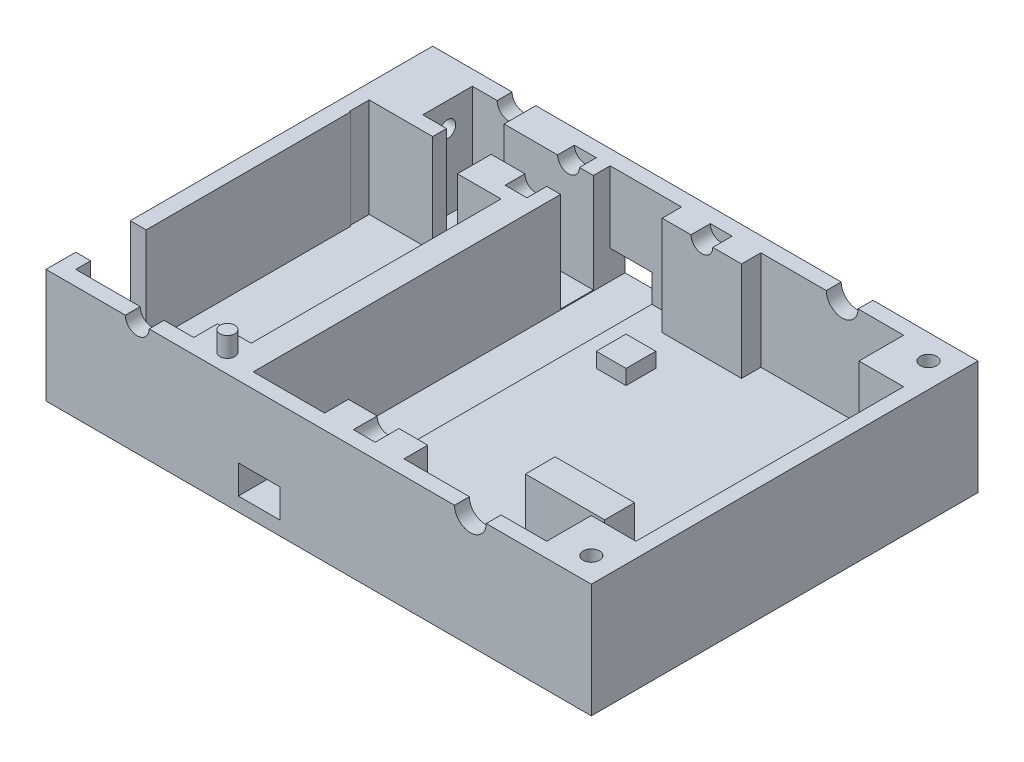
from build123d import *

# Parameters (mm, degrees)
SKETCH_1_W            = 55
SKETCH_1_H            = 39
EXTRUDE_1_DEPTH       = 11.5
SHELL_1_T             = -1.5
SKETCH_2_R            = 1.6
SKETCH_2_R_2          = 1.2
SKETCH_2_W            = 4.2
SKETCH_2_H            = 2.9
CUT_EXTRUDE_1_DEPTH   = 50.086658065
SKETCH_3_W            = 0.1
SKETCH_3_H            = 20.6
SKETCH_3_W_2          = 9
SKETCH_3_H_2          = 1.7
SKETCH_3_W_3          = 8
SKETCH_3_H_3          = 1.95
SKETCH_3_H_4          = 2.4
SKETCH_3_W_4          = 4.5
SKETCH_3_H_5          = 4.5
EXTRUDE_2_DEPTH       = 10
CUT_EXTRUDE_START     = -1.5
SKETCH_4_R            = 1.1
CUT_EXTRUDE_2_DEPTH   = 36
SKETCH_5_R            = 1.1
CUT_EXTRUDE_3_DEPTH   = 7
EXTRUDE_3_DEPTH       = 1.5
EXTRUDE_3_DEPTH_BACK  = 1.5
SKETCH_6_W            = 3
SKETCH_6_H            = 3
SKETCH_6_W_2          = 4.5
SKETCH_6_H_2          = 8
SKETCH_7_R            = 1
SKETCH_7_R_2          = 0.825
CUT_EXTRUDE_4_DEPTH   = 40.198214245
SKETCH_8_R            = 1
CUT_EXTRUDE_5_DEPTH   = 39.784661917
CUT_EXTRUDE_6_REACH   = 61.477
SKETCH_9_R            = 0.825
SKETCH_10_W           = 8
SKETCH_10_H           = 3
F_3MM_4_DEPTH         = 7
CUT_EXTRUDE_4_2_REACH = 61.477
SKETCH_11_W           = 5.5
SKETCH_11_H           = 8
SKETCH_12_R           = 0.75
EXTRUDE_5_DEPTH       = 2


with BuildPart() as part:
    # 草图1 → 凸台-拉伸1 (new body)
    with BuildSketch(Plane(origin=(0, 0, 0), x_dir=(1, 0, 0), z_dir=(0, 1, 0))):
        Rectangle(SKETCH_1_W, SKETCH_1_H)
    extrude(amount=EXTRUDE_1_DEPTH)

    # 抽壳1
    shell_1_openings = [part.faces().sort_by_distance(p)[0] for p in [
        (0, 11.5, 0),
    ]]
    offset(amount=SHELL_1_T, openings=shell_1_openings, kind=Kind.INTERSECTION)

    # 草图2 → 切除-拉伸1 (cut, through all)
    with BuildSketch(Plane(origin=(0, 0, -19.5), x_dir=(-1, 0, 0), z_dir=(0, 0, -1))):
        with Locations((-15.3, 11.5)):
            Circle(SKETCH_2_R)
        with Locations((18.3, 11.5)):
            Circle(SKETCH_2_R_2)
        with Locations((6, 2.85)):
            Rectangle(SKETCH_2_W, SKETCH_2_H)
    extrude(amount=-CUT_EXTRUDE_1_DEPTH, mode=Mode.SUBTRACT)

    # 草图3 → 凸台-拉伸2 (add)
    with BuildSketch(Plane(origin=(0, 1.5, 0), x_dir=(1, 0, 0), z_dir=(0, 1, 0))):
        Polygon((-10.7, 9.6), (-10.7, -15.6), (-14.1, -15.6), (-14.1, -18), (-10.7, -18), (-8.1, -18), (-8.1, 13), (-15.1, 13), (-15.1, 9.6), align=None)
        with Locations((-25.95, -0.7)):
            Rectangle(SKETCH_3_W, SKETCH_3_H)
        with Locations((-12.6, 17.15)):
            Rectangle(SKETCH_3_W_2, SKETCH_3_H_2)
        with Locations((3.1, 17.025)):
            Rectangle(SKETCH_3_W_3, SKETCH_3_H_3)
        with Locations((3.1, -16.8)):
            Rectangle(SKETCH_3_W_3, SKETCH_3_H_4)
        with Locations((23.75, 15.75)):
            Rectangle(SKETCH_3_W_4, SKETCH_3_H_5)
        with Locations((23.75, -15.75)):
            Rectangle(SKETCH_3_W_4, SKETCH_3_H_5)
        Polygon((-26, 18), (-22, 18), (-22, 13), (-19.6, 13), (-19.6, 11.6), (-26, 11.6), (-26, 13), align=None)
    extrude(amount=EXTRUDE_2_DEPTH)

    # 草图4 → 切除-拉伸2 (cut)
    with BuildSketch(Plane.XY.offset(19.5).offset(CUT_EXTRUDE_START)):
        with Locations((3.1, 11.5)):
            Circle(SKETCH_4_R)
    extrude(amount=-CUT_EXTRUDE_2_DEPTH, mode=Mode.SUBTRACT)

    # 草图5 → 切除-拉伸3 (cut)
    with BuildSketch(Plane(origin=(0, 0, -19.5), x_dir=(-1, 0, 0), z_dir=(0, 0, -1)).offset(CUT_EXTRUDE_START)):
        with Locations((10.6, 11.5)):
            Circle(SKETCH_5_R)
    extrude(amount=-CUT_EXTRUDE_3_DEPTH, mode=Mode.SUBTRACT)

    # 草图6 → 变速卡位凸台-拉伸3 (add, two sides: drawn at the far end of the back side and taken through both)
    with BuildSketch(Plane(origin=(0, 1.5, 0), x_dir=(1, 0, 0), z_dir=(0, 1, 0)).offset(-EXTRUDE_3_DEPTH_BACK)):
        with Locations((0.4, 11.1)):
            Rectangle(SKETCH_6_W, SKETCH_6_H)
        with Locations((-29.75, 0)):
            Rectangle(SKETCH_6_W_2, SKETCH_6_H_2)
    extrude(amount=EXTRUDE_3_DEPTH + EXTRUDE_3_DEPTH_BACK)

    # 草图7 → Cut-Extrude 4 (cut, through all)
    with BuildSketch(Plane.XZ):
        with Locations(Location((-29.8, 0, 0), (0, 0, 270))):
            Circle(SKETCH_7_R)
        with Locations(Location((25, 17, 0), (0, 0, 270))):
            Circle(SKETCH_7_R_2)
        with Locations(Location((25, -17, 0), (0, 0, 270))):
            Circle(SKETCH_7_R_2)
    extrude(amount=-CUT_EXTRUDE_4_DEPTH, mode=Mode.SUBTRACT)

    # 草图8 → 底部螺丝孔切除-拉伸5 (cut, through all)
    with BuildSketch(Plane(origin=(0, 1.5, 0), x_dir=(1, 0, 0), z_dir=(0, 1, 0))):
        with Locations(Location((23, 7.6, 0), (0, 0, 270))):
            Circle(SKETCH_8_R)
        with Locations(Location((23, -10.5, 0), (0, 0, 270))):
            Circle(SKETCH_8_R)
    extrude(amount=-CUT_EXTRUDE_5_DEPTH, mode=Mode.SUBTRACT)

    # 草图9 → 前螺丝孔切除-拉伸6 (cut, up to next)
    with BuildSketch(Plane.ZY.offset(27.5), mode=Mode.PRIVATE) as cut_extrude_6_sk1:
        with Locations((-15.501988962, 9)):
            Circle(SKETCH_9_R)
    cut_extrude_6_tool1 = extrude(cut_extrude_6_sk1.sketch, amount=-CUT_EXTRUDE_6_REACH, mode=Mode.PRIVATE) & part.part
    add(cut_extrude_6_tool1.solids().sort_by_distance((-27.5, 9, -15.501989))[0], mode=Mode.SUBTRACT)

    # 草图10 → 3mm轴卡位凸台-拉伸4 (add)
    with BuildSketch(Plane(origin=(0, 1.5, 0), x_dir=(1, 0, 0), z_dir=(0, 1, 0))):
        with Locations((15.55, -8.7)):
            Rectangle(SKETCH_10_W, SKETCH_10_H)
    extrude(amount=F_3MM_4_DEPTH)

    # 草图11 → Cut-Extrude 4 2 (cut, up to next)
    with BuildSketch(Plane.ZY.offset(27.5), mode=Mode.PRIVATE) as cut_extrude_4_2_sk1:
        with Locations((13.75, 7.5)):
            Rectangle(SKETCH_11_W, SKETCH_11_H)
    cut_extrude_4_2_tool1 = extrude(cut_extrude_4_2_sk1.sketch, amount=-CUT_EXTRUDE_4_2_REACH, mode=Mode.PRIVATE) & part.part
    add(cut_extrude_4_2_tool1.solids().sort_by_distance((-27.5, 7.5, 13.75))[0], mode=Mode.SUBTRACT)

    # 草图12 → 凸台-拉伸5 (add)
    with BuildSketch(Plane(origin=(0, 11.5, 0), x_dir=(1, 0, 0), z_dir=(0, 1, 0))):
        with Locations(Location((-11.1, -17.6, 0), (0, 0, 270))):
            Circle(SKETCH_12_R)
    extrude(amount=EXTRUDE_5_DEPTH)


solid = part.part
